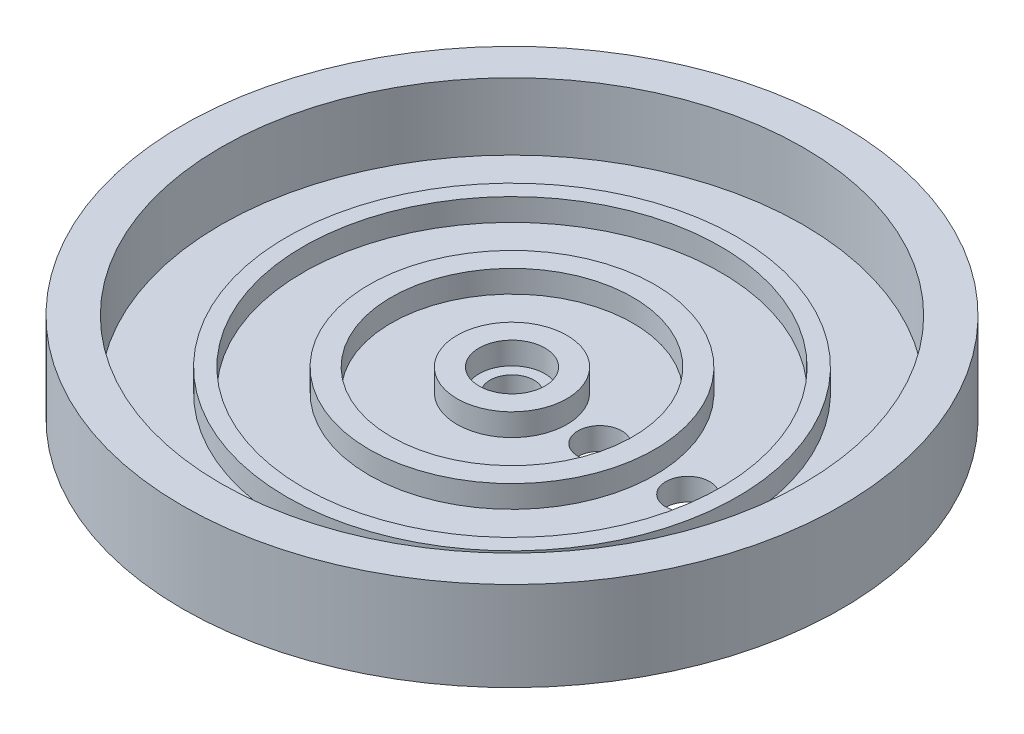
from build123d import *

# Parameters (mm, degrees)
SKETCH2_R           = 15
SKETCH2_R_2         = 1
BOSS_EXTRUDE2_DEPTH = 1.016
SKETCH3_R           = 15
SKETCH3_R_2         = 13.25
SKETCH3_R_3         = 10.25
SKETCH3_R_4         = 9.5
SKETCH3_R_5         = 6.5
SKETCH3_R_6         = 5.5
SKETCH3_R_7         = 2.5
SKETCH3_R_8         = 1.5
BOSS_EXTRUDE4_DEPTH = 1.016
SKETCH5_R           = 15
SKETCH5_R_2         = 13.25
BOSS_EXTRUDE5_DEPTH = 2.032


with BuildPart() as part:
    # Sketch2 → Boss-Extrude2 (new body)
    with BuildSketch(Plane(origin=(0, 0, 0), x_dir=(1, 0, 0), z_dir=(0, 1, 0))):
        with Locations(Location((0, 0, 0), (0, 0, 270))):
            Circle(SKETCH2_R)
        with Locations(Location((0, 0, 0), (0, 0, 270))):
            Circle(SKETCH2_R_2, mode=Mode.SUBTRACT)
        with Locations(Location((4, 0, 0), (0, 0, 270))):
            Circle(SKETCH2_R_2, mode=Mode.SUBTRACT)
        with Locations(Location((8, 0, 0), (0, 0, 270))):
            Circle(SKETCH2_R_2, mode=Mode.SUBTRACT)
    extrude(amount=BOSS_EXTRUDE2_DEPTH)

    # Sketch3 → Boss-Extrude4 (add)
    # profile 1 of 4: a face of its own
    with BuildSketch(Plane(origin=(0, 1.016, 0), x_dir=(1, 0, 0), z_dir=(0, 1, 0))):
        with Locations(Location((0, 0, 0), (0, 0, 270))):
            Circle(SKETCH3_R)
        with Locations(Location((0, 0, 0), (0, 0, 270))):
            Circle(SKETCH3_R_2, mode=Mode.SUBTRACT)
    # profile 2 of 4: a face of its own
    with BuildSketch(Plane(origin=(0, 1.016, 0), x_dir=(1, 0, 0), z_dir=(0, 1, 0))):
        with Locations(Location((0, 0, 0), (0, 0, 270))):
            Circle(SKETCH3_R_3)
        with Locations(Location((0, 0, 0), (0, 0, 270))):
            Circle(SKETCH3_R_4, mode=Mode.SUBTRACT)
    # profile 3 of 4: a face of its own
    with BuildSketch(Plane(origin=(0, 1.016, 0), x_dir=(1, 0, 0), z_dir=(0, 1, 0))):
        with Locations(Location((0, 0, 0), (0, 0, 270))):
            Circle(SKETCH3_R_5)
        with Locations(Location((0, 0, 0), (0, 0, 270))):
            Circle(SKETCH3_R_6, mode=Mode.SUBTRACT)
    # profile 4 of 4: a face of its own
    with BuildSketch(Plane(origin=(0, 1.016, 0), x_dir=(1, 0, 0), z_dir=(0, 1, 0))):
        with Locations(Location((0, 0, 0), (0, 0, 270))):
            Circle(SKETCH3_R_7)
        with Locations(Location((0, 0, 0), (0, 0, 270))):
            Circle(SKETCH3_R_8, mode=Mode.SUBTRACT)
    extrude(amount=BOSS_EXTRUDE4_DEPTH)

    # Sketch5 → Boss-Extrude5 (add)
    with BuildSketch(Plane(origin=(0, 2.032, 0), x_dir=(1, 0, 0), z_dir=(0, 1, 0))):
        with Locations(Location((0, 0, 0), (0, 0, 270))):
            Circle(SKETCH5_R)
        with Locations(Location((0, 0, 0), (0, 0, 270))):
            Circle(SKETCH5_R_2, mode=Mode.SUBTRACT)
    extrude(amount=BOSS_EXTRUDE5_DEPTH)


solid = part.part
